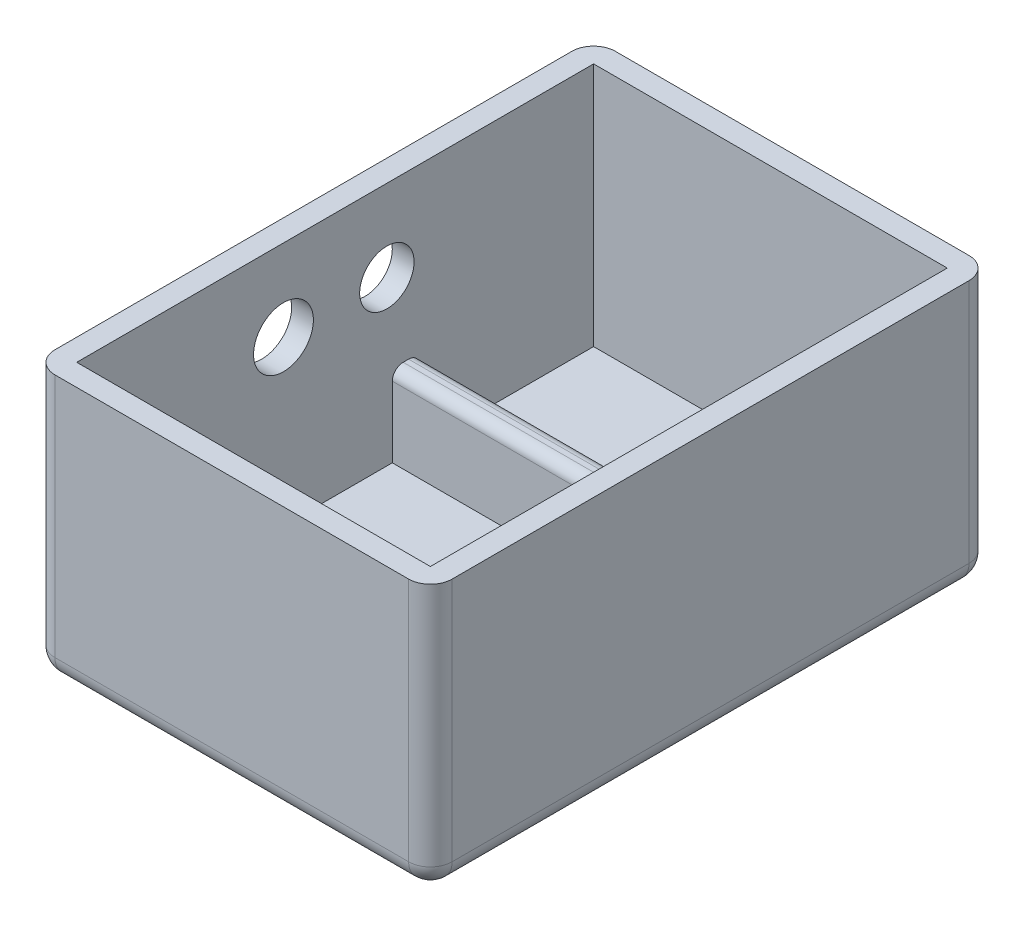
from build123d import *

# Parameters (mm, degrees)
SKETCH1_W           = 65
SKETCH1_H           = 95
BOSS_EXTRUDE1_DEPTH = 45
SHELL4_T            = 4
SKETCH3_W           = 65
SKETCH3_H           = 5
BOSS_EXTRUDE3_DEPTH = 15
SKETCH4_R           = 5
SKETCH4_R_2         = 5.5
CUT_EXTRUDE1_DEPTH  = 5
FILLET1_R           = 4
FILLET2_R           = 2


with BuildPart() as part:
    # Sketch1 → Boss-Extrude1 (new body)
    with BuildSketch(Plane(origin=(0, 0, 0), x_dir=(1, 0, 0), z_dir=(0, 1, 0))):
        Rectangle(SKETCH1_W, SKETCH1_H)
    extrude(amount=BOSS_EXTRUDE1_DEPTH)

    # Shell4
    shell4_openings = [part.faces().sort_by_distance(p)[0] for p in [
        (0, 45, 0),
    ]]
    offset(amount=SHELL4_T, openings=shell4_openings, kind=Kind.INTERSECTION)

    # Sketch3 → Boss-Extrude3 (add)
    with BuildSketch(Plane(origin=(0, 0, 0), x_dir=(1, 0, 0), z_dir=(0, 1, 0))):
        with Locations((0, 13)):
            Rectangle(SKETCH3_W, SKETCH3_H)
    extrude(amount=BOSS_EXTRUDE3_DEPTH)

    # Sketch4 → Cut-Extrude1 (cut)
    with BuildSketch(Plane(origin=(-32.5, 0, 0), x_dir=(0, 0, -1), z_dir=(1, 0, 0))):
        with Locations((9.5, 30)):
            Circle(SKETCH4_R)
        with Locations((-9.5, 30)):
            Circle(SKETCH4_R_2)
    extrude(amount=-CUT_EXTRUDE1_DEPTH, mode=Mode.SUBTRACT)

    # Fillet1
    fillet1_edges = [part.edges().sort_by_distance(p)[0] for p in [
        (0, -4, 51.5),
        (-36.5, -4, 0),
        (0, -4, -51.5),
        (36.5, -4, 0),
        (36.5, 20.5, 51.5),
        (-36.5, 20.5, 51.5),
        (-36.5, 20.5, -51.5),
        (36.5, 20.5, -51.5),
    ]]
    fillet(fillet1_edges, radius=FILLET1_R)

    # Fillet2
    fillet2_edges = [part.edges().sort_by_distance(p)[0] for p in [
        (0, 15, -10.5),
        (0, 15, -15.5),
    ]]
    fillet(fillet2_edges, radius=FILLET2_R)


solid = part.part
